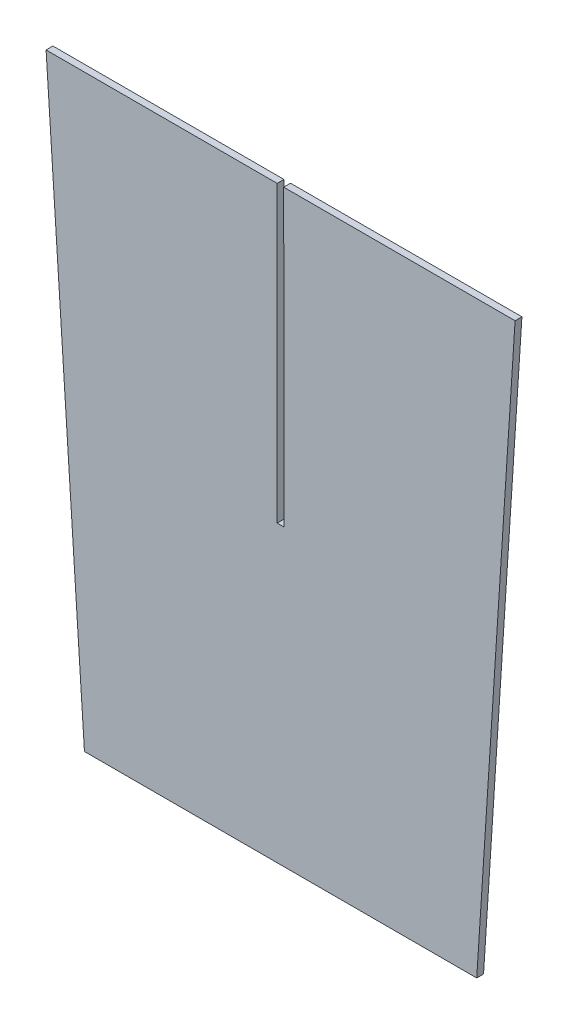
from build123d import *

# Parameters (mm, degrees)
BOSS_EXTRUDE1_DEPTH = 4


with BuildPart() as part:
    # Sketch4 → Boss-Extrude1 (new body)
    with BuildSketch(Plane.XY):
        Polygon((-22.5, 345), (0, 0), (230, 0), (252.5, 345), (116.824151074, 345), (117, 172.5), (113, 172.5), (113, 345), align=None)
    extrude(amount=BOSS_EXTRUDE1_DEPTH)


solid = part.part
